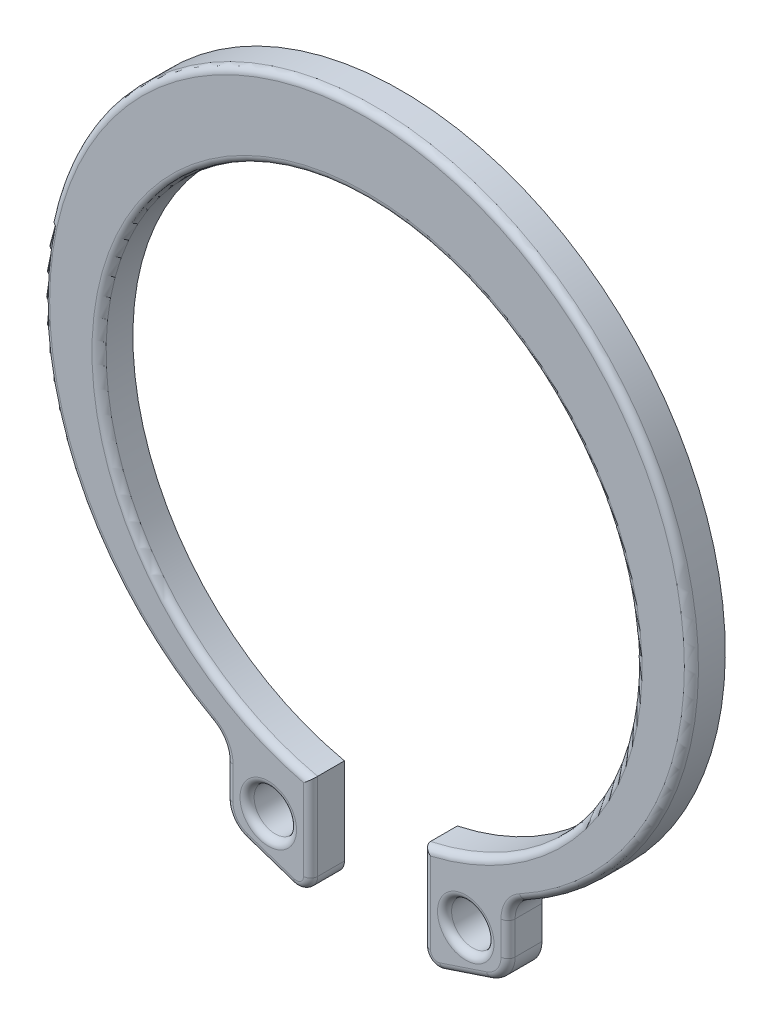
from build123d import *

# Parameters (mm, degrees)
SKETCH1_R           = 0.751639909
BOSS_EXTRUDE1_DEPTH = 1.2
FILLET1_R           = 0.25


with BuildPart() as part:
    # Sketch1 → Boss-Extrude1 (new body)
    with BuildSketch(Plane.XY):
        with BuildLine():
            Line((-2, -9.287087811), (-2, -10.524751653))
            Line((-2, -10.524751653), (-2, -12.362444645))
            ThreePointArc((-2, -12.362444645), (-2.207644858, -12.768065738), (-2.658113883, -12.836786294))
            Line((-2.658113883, -12.836786294), (-4.316227766, -12.284081667))
            ThreePointArc((-4.316227766, -12.284081667), (-4.811242185, -11.920108653), (-5, -11.335398369))
            Line((-5, -11.335398369), (-5, -10.1658561))
            ThreePointArc((-5, -10.1658561), (-5.139767473, -9.655954148), (-5.52, -9.288587612))
            ThreePointArc((-5.52, -9.288587612), (0, 12.3), (5.52, -9.288587612))
            ThreePointArc((5.52, -9.288587612), (5.139767473, -9.655954148), (5, -10.1658561))
            Line((5, -10.1658561), (5, -11.335398369))
            ThreePointArc((5, -11.335398369), (4.811242185, -11.920108653), (4.316227766, -12.284081667))
            Line((4.316227766, -12.284081667), (2.658113883, -12.836786294))
            ThreePointArc((2.658113883, -12.836786294), (2.207644858, -12.768065738), (2, -12.362444645))
            Line((2, -12.362444645), (2, -10.524751653))
            Line((2, -10.524751653), (2, -9.287087811))
            ThreePointArc((2, -9.287087811), (0, 9.5), (-2, -9.287087811))
        make_face()
        with Locations((-3.5, -11.056157589)):
            Circle(SKETCH1_R, mode=Mode.SUBTRACT)
        with Locations(Location((3.5, -11.056157589, 0), (0, 0, 180))):
            Circle(SKETCH1_R, mode=Mode.SUBTRACT)
    extrude(amount=BOSS_EXTRUDE1_DEPTH)

    # Fillet1
    fillet1_edges = [part.edges().sort_by_distance(p)[0] for p in [
        (-4.811242185, -11.920108653, 1.2),
        (-3.487170825, -12.56043398, 1.2),
        (-2.207644858, -12.768065738, 1.2),
        (-2, -10.824766228, 1.2),
        (0, 9.5, 1.2),
        (2, -10.824766228, 1.2),
        (2.207644858, -12.768065738, 1.2),
        (3.487170825, -12.56043398, 1.2),
        (-4.251639909, -11.056157589, 1.2),
        (-5.139767473, -9.655954148, 1.2),
        (4.811242185, -11.920108653, 1.2),
        (5, -10.750627234, 1.2),
        (4.251639909, -11.056157589, 1.2),
        (5.139767473, -9.655954148, 1.2),
        (0, 12.3, 1.2),
        (-5, -10.750627234, 1.2),
    ]]
    fillet(fillet1_edges, radius=FILLET1_R)


solid = part.part
